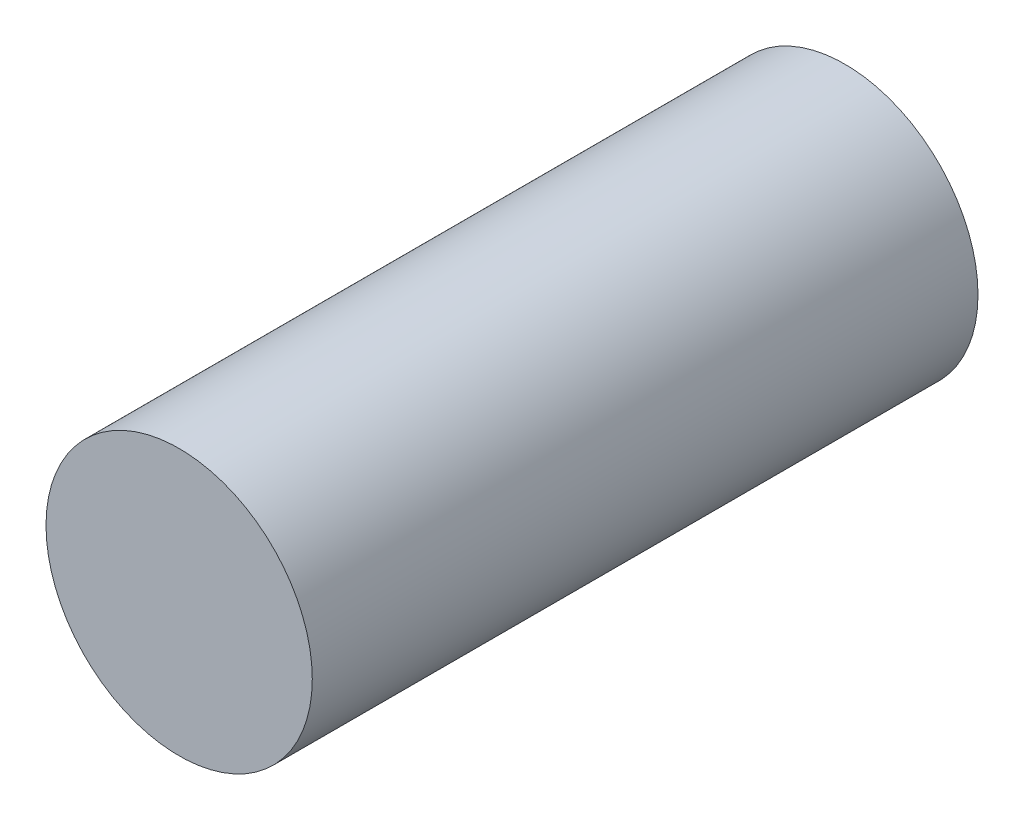
from build123d import *

# Parameters (mm, degrees)
TOPPING_KAT2_KAPAK_PIMI_D8_2_START = -40
SKETCH1_R                          = 4
TOPPING_KAT2_KAPAK_PIMI_D8_2_DEPTH = 20


with BuildPart() as part:
    # Sketch1 → TOPPING_kat2_kapak_pimi_D8_2 (new body)
    with BuildSketch(Plane.XY.offset(TOPPING_KAT2_KAPAK_PIMI_D8_2_START)):
        with Locations((460, 1334)):
            Circle(SKETCH1_R)
    extrude(amount=-TOPPING_KAT2_KAPAK_PIMI_D8_2_DEPTH)


solid = part.part
